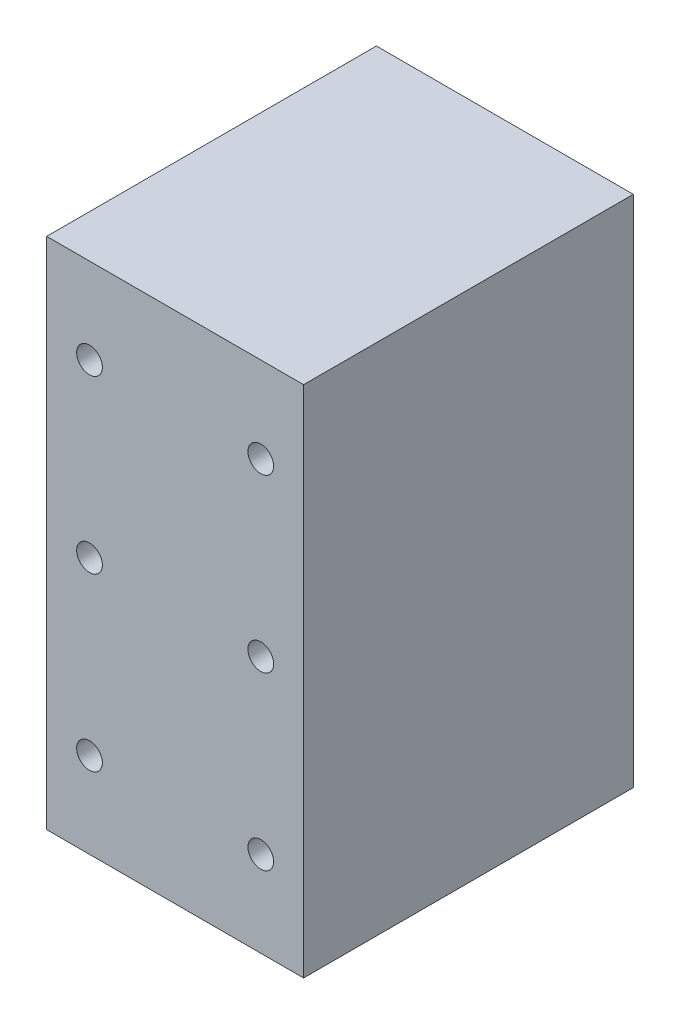
from build123d import *

# Parameters (mm, degrees)
ESQUISSE1_W                     = 30
ESQUISSE1_H                     = 60
EXTRUSION1_DEPTH                = 38.5
ESQUISSE2_R                     = 1.5
EXTRUSION2_DEPTH                = 52.061237744
R_P_TITION_LIN_AIRE1_COUNT      = 3
R_P_TITION_LIN_AIRE1_PITCH      = 20
R_P_TITION_LIN_AIRE1_COUNT_DIR2 = 2
R_P_TITION_LIN_AIRE1_PITCH_DIR2 = 20


with BuildPart() as part:
    # Esquisse1 → Extrusion1 (new body)
    with BuildSketch(Plane.XY):
        Rectangle(ESQUISSE1_W, ESQUISSE1_H)
    extrude(amount=EXTRUSION1_DEPTH)

    # Esquisse2 → Extrusion2 (cut, through all)
    with BuildSketch(Plane.XY.offset(38.5)):
        with Locations((-10, 20)):
            Circle(ESQUISSE2_R)
    extrusion2 = extrude(amount=-EXTRUSION2_DEPTH, mode=Mode.SUBTRACT)

    # Répétition linéaire1: Extrusion2 3 × 2
    with Locations(*[(j * R_P_TITION_LIN_AIRE1_PITCH_DIR2, -i * R_P_TITION_LIN_AIRE1_PITCH, 0) for i in range(R_P_TITION_LIN_AIRE1_COUNT) for j in range(R_P_TITION_LIN_AIRE1_COUNT_DIR2) if (i, j) != (0, 0)]):
        add(extrusion2, mode=Mode.SUBTRACT)


solid = part.part
